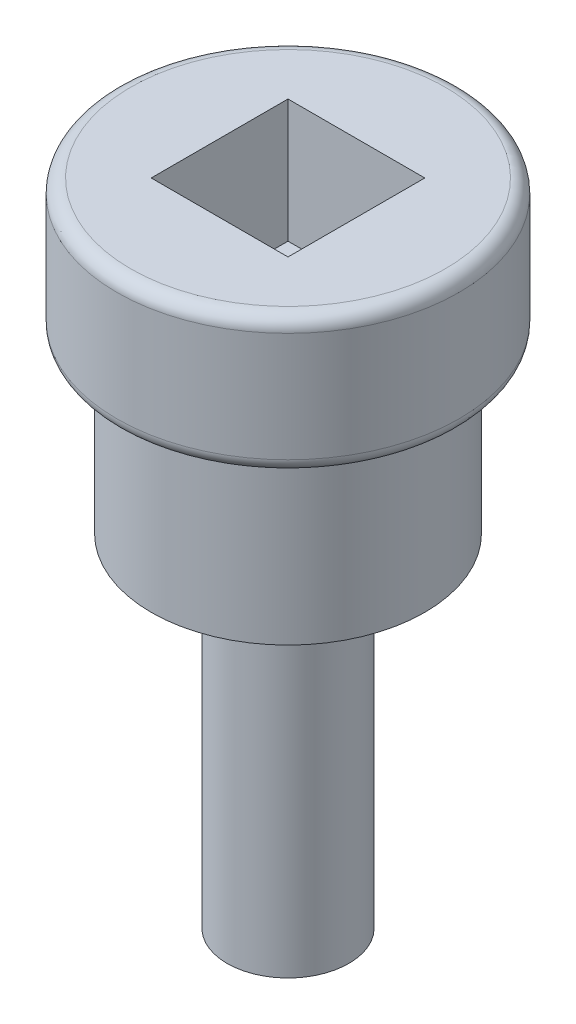
from build123d import *

# Parameters (mm, degrees)
SKETCH1_R           = 2.54
BOSS_EXTRUDE1_DEPTH = 5.715
SKETCH2_R           = 1.1303
BOSS_EXTRUDE2_DEPTH = 12.065
SKETCH4_R           = 3.175
BOSS_EXTRUDE3_DEPTH = 2.54
SKETCH3_W           = 2.54
SKETCH3_H           = 2.54
CUT_EXTRUDE1_DEPTH  = 2.286
FILLET1_R           = 0.254


with BuildPart() as part:
    # Sketch1 → Boss-Extrude1 (new body)
    with BuildSketch(Plane(origin=(0, 0, 0), x_dir=(1, 0, 0), z_dir=(0, 1, 0))):
        with Locations(Location((0, 0, 0), (0, 0, 270))):
            Circle(SKETCH1_R)
    extrude(amount=-BOSS_EXTRUDE1_DEPTH)

    # Sketch2 → Boss-Extrude2 (add)
    with BuildSketch(Plane(origin=(0, 0, 0), x_dir=(1, 0, 0), z_dir=(0, 1, 0))):
        with Locations(Location((0, 0, 0), (0, 0, 270))):
            Circle(SKETCH2_R)
    extrude(amount=-BOSS_EXTRUDE2_DEPTH)

    # Sketch4 → Boss-Extrude3 (add)
    with BuildSketch(Plane(origin=(0, 0, 0), x_dir=(1, 0, 0), z_dir=(0, 1, 0))):
        with Locations(Location((0, 0, 0), (0, 0, 270))):
            Circle(SKETCH4_R)
    extrude(amount=-BOSS_EXTRUDE3_DEPTH)

    # Sketch3 → Cut-Extrude1 (cut)
    with BuildSketch(Plane(origin=(0, 0, 0), x_dir=(1, 0, 0), z_dir=(0, 1, 0))):
        Rectangle(SKETCH3_W, SKETCH3_H)
    extrude(amount=-CUT_EXTRUDE1_DEPTH, mode=Mode.SUBTRACT)

    # Fillet1
    fillet1_edges = [part.edges().sort_by_distance(p)[0] for p in [
        (0, -2.54, -3.175),
        (0, 0, -3.175),
    ]]
    fillet(fillet1_edges, radius=FILLET1_R)


solid = part.part
